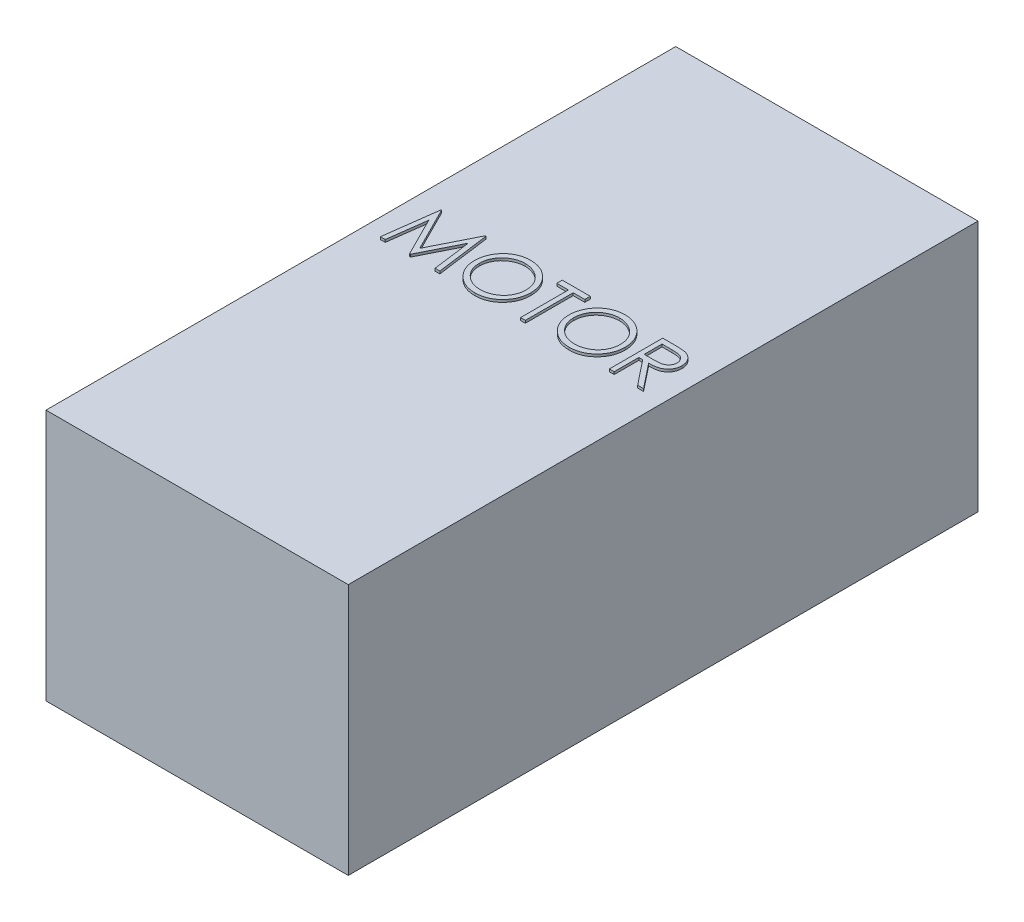
from build123d import *

# Parameters (mm, degrees)
SKETCH1_W           = 12
SKETCH1_H           = 10
BOSS_EXTRUDE1_DEPTH = 25
BOSS_EXTRUDE2_DEPTH = 0.1
SKETCH4_R           = 1.5
CUT_EXTRUDE1_DEPTH  = 5


with BuildPart() as part:
    # Sketch1 → Boss-Extrude1 (new body)
    with BuildSketch(Plane.XY):
        with Locations((6, 5)):
            Rectangle(SKETCH1_W, SKETCH1_H)
    extrude(amount=BOSS_EXTRUDE1_DEPTH)

    # Sketch3 → Boss-Extrude2 (add)
    # profile 1 of 5: a face of its own
    with BuildSketch(Plane(origin=(0, 10, 0), x_dir=(1, 0, 0), z_dir=(0, 1, 0))):
        Polygon((0.776175214, -12.5), (1.055598958, -10.383333333), (1.08273571, -10.383333333), (1.956623932, -12.12008547), (2.828392094, -10.383333333), (2.855952858, -10.383333333), (3.13707265, -12.5), (2.946267361, -12.5), (2.743589744, -10.976949786), (1.979520566, -12.5), (1.936695379, -12.5), (1.16965812, -10.973557692), (0.967404514, -12.5), align=None)
    # profile 2 of 5: a face of its own
    with BuildSketch(Plane(origin=(0, 10, 0), x_dir=(1, 0, 0), z_dir=(0, 1, 0))):
        with BuildLine():
            add(Edge.make_bspline(
                [(4.561752137, -10.329059829), (4.60094561, -10.330052533), (4.677924826, -10.332002286), (4.791060598, -10.346927268), (4.899068108, -10.372747813), (5.002827191, -10.407136379), (5.101096754, -10.453010221), (5.194616465, -10.508457906), (5.283163812, -10.574060336), (5.365545314, -10.649310392), (5.440933089, -10.731185148), (5.507351601, -10.818559884), (5.563015274, -10.910906302), (5.608726679, -11.0079469), (5.644588219, -11.109462214), (5.669334498, -11.215993444), (5.685141855, -11.326850347), (5.686989873, -11.402461832), (5.68792735, -11.440818643)],
                knots=[0, 0, 0, 0, 1.065120563, 2.091984664, 3.0946048, 4.079830382, 5.057816894, 6.036188127, 7.030412546, 8.04752943, 9.064399622, 10.05169764, 11.02544977, 11.989514704, 12.962713494, 13.945757189, 14.957906945, 16, 16, 16, 16], degree=3))
            add(Edge.make_bspline(
                [(5.68792735, -11.440818643), (5.68699001, -11.478892908), (5.685142404, -11.553941696), (5.669316525, -11.664095112), (5.644496491, -11.769983295), (5.609059702, -11.871429476), (5.563566198, -11.968540669), (5.50753188, -12.061061351), (5.441527434, -12.149021852), (5.366411862, -12.231458559), (5.28452647, -12.307052268), (5.196696737, -12.372922254), (5.10489792, -12.429603035), (5.007948715, -12.474829352), (4.907134884, -12.510977132), (4.801554145, -12.53562277), (4.691701229, -12.551520173), (4.616788765, -12.553345656), (4.578712607, -12.554273504)],
                knots=[0, 0, 0, 0, 1.043624062, 2.057103931, 3.04512605, 4.022047818, 4.998200453, 5.980619268, 6.982898556, 8.009068085, 9.034988726, 10.034168286, 11.015286542, 11.987931943, 12.962482838, 13.94673481, 14.956375938, 16, 16, 16, 16], degree=3))
            add(Edge.make_bspline(
                [(4.578712607, -12.554273504), (4.540355995, -12.553336494), (4.464744902, -12.551489398), (4.353748695, -12.535655881), (4.247142631, -12.510896141), (4.145231571, -12.475511863), (4.047958685, -12.429781442), (3.95513373, -12.374019746), (3.867129294, -12.307854475), (3.784674999, -12.232763261), (3.709231437, -12.151016656), (3.643457909, -12.063426416), (3.587683674, -11.971710973), (3.542106802, -11.875615803), (3.50602401, -11.775605455), (3.481407286, -11.671012804), (3.465480306, -11.562434151), (3.463644946, -11.488506303), (3.462713675, -11.450994925)],
                knots=[0, 0, 0, 0, 1.053102029, 2.075944431, 3.073151272, 4.055350789, 5.033113405, 6.020478099, 7.024410459, 8.052272461, 9.079885166, 10.07527673, 11.055994387, 12.023226415, 12.992069828, 13.970394897, 14.97016774, 16, 16, 16, 16], degree=3))
            add(Edge.make_bspline(
                [(3.462713675, -11.450994925), (3.463037002, -11.425817073), (3.463679578, -11.375778998), (3.471415506, -11.301473959), (3.482640916, -11.228363895), (3.498728739, -11.156656702), (3.519769414, -11.086527916), (3.544596116, -11.017493884), (3.574918785, -10.950254203), (3.609197081, -10.884490342), (3.647455413, -10.821227466), (3.689713604, -10.761428861), (3.734487375, -10.704592734), (3.783571903, -10.652191927), (3.835349468, -10.602702049), (3.890660011, -10.556883644), (3.949166035, -10.514323555), (4.011119283, -10.475969349), (4.074993192, -10.441280729), (4.14083772, -10.411513229), (4.207758599, -10.38596442), (4.276069267, -10.365256873), (4.345588324, -10.348908928), (4.416467499, -10.337776861), (4.488650323, -10.330021203), (4.537280026, -10.329381666), (4.561752137, -10.329059829)],
                knots=[0, 0, 0, 0, 1.037015668, 2.060948919, 3.074880161, 4.083647147, 5.086022904, 6.090072063, 7.104153813, 8.122640571, 9.144368836, 10.147691507, 11.138137339, 12.123020368, 13.103399296, 14.087645067, 15.080126199, 16.082011238, 17.087798457, 18.072939717, 19.057185487, 20.037253025, 21.01195951, 21.997135196, 22.992090687, 24, 24, 24, 24], degree=3))
        make_face()
        with BuildLine():
            add(Edge.make_bspline(
                [(4.571080395, -10.546153846), (4.55099345, -10.546398708), (4.511011593, -10.546886092), (4.451572849, -10.553306072), (4.392915823, -10.562456053), (4.335028399, -10.575507734), (4.278152786, -10.593290185), (4.221758834, -10.613755877), (4.166360797, -10.638684823), (4.112141559, -10.66685022), (4.059578633, -10.698025044), (4.009980475, -10.732479398), (3.963218686, -10.769405285), (3.919407758, -10.808888882), (3.878676335, -10.851131261), (3.840222729, -10.89549202), (3.805588268, -10.943239116), (3.773846991, -10.99307779), (3.74544263, -11.044943127), (3.720184535, -11.098289092), (3.699523444, -11.153550836), (3.68267334, -11.210128826), (3.668703454, -11.267933457), (3.659853414, -11.327403232), (3.653362892, -11.388239323), (3.652903367, -11.429352159), (3.65267094, -11.450146902)],
                knots=[0, 0, 0, 0, 1.008559885, 2.007477868, 2.99961109, 3.989939068, 4.984837346, 5.991145699, 7.001802488, 8.033829008, 9.059044045, 10.069351652, 11.065060232, 12.050310815, 13.029377138, 14.011219647, 14.996725999, 15.989392538, 16.977580475, 17.965360261, 18.951710183, 19.937753436, 20.929683414, 21.935841486, 22.955955122, 24, 24, 24, 24], degree=3))
            add(Edge.make_bspline(
                [(3.65267094, -11.450146902), (3.653441928, -11.480725007), (3.6549587, -11.540881599), (3.668237802, -11.629036619), (3.688692044, -11.713756678), (3.718843879, -11.794578214), (3.756551156, -11.872195947), (3.803134085, -11.945921324), (3.858324103, -12.015774272), (3.921015855, -12.081267125), (3.989549111, -12.141045302), (4.062321762, -12.193516506), (4.138554182, -12.237912229), (4.218445166, -12.274080058), (4.301568202, -12.302739566), (4.388458911, -12.322381405), (4.478538475, -12.335308466), (4.539940347, -12.336549895), (4.571080395, -12.337179487)],
                knots=[0, 0, 0, 0, 1.032063989, 2.030389145, 3.003944642, 3.970395727, 4.937377036, 5.913328081, 6.909231446, 7.93887556, 8.970685674, 9.976071282, 10.964166581, 11.944589148, 12.933237628, 13.927779006, 14.949070134, 16, 16, 16, 16], degree=3))
            add(Edge.make_bspline(
                [(4.571080395, -12.337179487), (4.592010903, -12.33689192), (4.633522387, -12.336321589), (4.69526587, -12.330577151), (4.755897007, -12.321365496), (4.815330758, -12.308102671), (4.873499667, -12.291503647), (4.930646525, -12.271783735), (4.986162633, -12.247181293), (5.040748345, -12.219998484), (5.092997501, -12.189010389), (5.142875561, -12.155725412), (5.18912532, -12.118853913), (5.232903473, -12.07995695), (5.273802123, -12.038250242), (5.311544699, -11.993788013), (5.346004112, -11.946289615), (5.377733336, -11.896526537), (5.406038167, -11.844519279), (5.430699812, -11.790979902), (5.451622225, -11.736040241), (5.468512321, -11.679621053), (5.481747814, -11.621829492), (5.490867576, -11.562588178), (5.497246869, -11.502015623), (5.497727702, -11.46104672), (5.497970085, -11.440394631)],
                knots=[0, 0, 0, 0, 1.047197238, 2.076906641, 3.100256066, 4.114471768, 5.12198147, 6.126382909, 7.136867548, 8.15857795, 9.17633901, 10.174870724, 11.156907918, 12.133735059, 13.104061851, 14.077631395, 15.04955518, 16.038496417, 17.029181396, 18.010275684, 18.986308667, 19.968651475, 20.955262928, 21.950658345, 22.966943676, 24, 24, 24, 24], degree=3))
            add(Edge.make_bspline(
                [(5.497970085, -11.440394631), (5.497727508, -11.419883826), (5.49724631, -11.379196867), (5.490870623, -11.319046753), (5.48173818, -11.260231715), (5.468576923, -11.202982653), (5.451613258, -11.147284974), (5.430696159, -11.093190988), (5.406030763, -11.040499175), (5.377722932, -10.989339767), (5.345902887, -10.940248378), (5.311132558, -10.893317395), (5.27281161, -10.849428166), (5.232034919, -10.807497184), (5.187783955, -10.768418746), (5.140259167, -10.732179888), (5.090037515, -10.697906051), (5.036862472, -10.666987259), (4.981983986, -10.63843389), (4.925672211, -10.613970664), (4.868565089, -10.593183716), (4.81080784, -10.575453932), (4.751914325, -10.562507171), (4.692282485, -10.553297826), (4.631994824, -10.546888326), (4.591449639, -10.54639945), (4.571080395, -10.546153846)],
                knots=[0, 0, 0, 0, 1.02996197, 2.043119294, 3.035359645, 4.018872909, 4.991431989, 5.957985074, 6.929999688, 7.912076566, 8.892894881, 9.867085534, 10.843653904, 11.817741046, 12.803660682, 13.806313499, 14.818574707, 15.856120519, 16.894564902, 17.924820532, 18.937903209, 19.946497019, 20.957711757, 21.963978472, 22.977135795, 24, 24, 24, 24], degree=3))
        make_face(mode=Mode.SUBTRACT)
    # profile 3 of 5: a face of its own
    with BuildSketch(Plane(origin=(0, 10, 0), x_dir=(1, 0, 0), z_dir=(0, 1, 0))):
        Polygon((5.877884615, -10.60042735), (5.877884615, -10.383333333), (6.990491453, -10.383333333), (6.990491453, -10.60042735), (6.529166667, -10.60042735), (6.529166667, -12.5), (6.339209402, -12.5), (6.339209402, -10.60042735), align=None)
    # profile 4 of 5: a face of its own
    with BuildSketch(Plane(origin=(0, 10, 0), x_dir=(1, 0, 0), z_dir=(0, 1, 0))):
        with BuildLine():
            add(Edge.make_bspline(
                [(8.306623932, -10.329059829), (8.345817405, -10.330052533), (8.422796621, -10.332002286), (8.535932392, -10.346927268), (8.643939902, -10.372747813), (8.747698986, -10.407136379), (8.845968548, -10.453010221), (8.93948826, -10.508457906), (9.028035607, -10.574060336), (9.110417109, -10.649310392), (9.185804884, -10.731185148), (9.252223396, -10.818559884), (9.307887069, -10.910906302), (9.353598474, -11.0079469), (9.389460014, -11.109462214), (9.414206293, -11.215993444), (9.43001365, -11.326850347), (9.431861668, -11.402461832), (9.432799145, -11.440818643)],
                knots=[0, 0, 0, 0, 1.065120563, 2.091984664, 3.0946048, 4.079830382, 5.057816894, 6.036188127, 7.030412546, 8.04752943, 9.064399622, 10.05169764, 11.02544977, 11.989514704, 12.962713494, 13.945757189, 14.957906945, 16, 16, 16, 16], degree=3))
            add(Edge.make_bspline(
                [(9.432799145, -11.440818643), (9.431861805, -11.478892908), (9.430014199, -11.553941696), (9.414188319, -11.664095112), (9.389368286, -11.769983295), (9.353931497, -11.871429476), (9.308437993, -11.968540669), (9.252403675, -12.061061351), (9.186399229, -12.149021852), (9.111283657, -12.231458559), (9.029398265, -12.307052268), (8.941568532, -12.372922254), (8.849769715, -12.429603035), (8.75282051, -12.474829352), (8.652006678, -12.510977132), (8.54642594, -12.53562277), (8.436573024, -12.551520173), (8.36166056, -12.553345656), (8.323584402, -12.554273504)],
                knots=[0, 0, 0, 0, 1.043624062, 2.057103931, 3.04512605, 4.022047818, 4.998200453, 5.980619268, 6.982898556, 8.009068085, 9.034988726, 10.034168286, 11.015286542, 11.987931943, 12.962482838, 13.94673481, 14.956375938, 16, 16, 16, 16], degree=3))
            add(Edge.make_bspline(
                [(8.323584402, -12.554273504), (8.28522779, -12.553336494), (8.209616697, -12.551489398), (8.09862049, -12.535655881), (7.992014426, -12.510896141), (7.890103366, -12.475511863), (7.79283048, -12.429781442), (7.700005525, -12.374019746), (7.612001089, -12.307854475), (7.529546794, -12.232763261), (7.454103232, -12.151016656), (7.388329704, -12.063426416), (7.332555469, -11.971710973), (7.286978597, -11.875615803), (7.250895805, -11.775605455), (7.226279081, -11.671012804), (7.210352101, -11.562434151), (7.208516741, -11.488506303), (7.20758547, -11.450994925)],
                knots=[0, 0, 0, 0, 1.053102029, 2.075944431, 3.073151272, 4.055350789, 5.033113405, 6.020478099, 7.024410459, 8.052272461, 9.079885166, 10.07527673, 11.055994387, 12.023226415, 12.992069828, 13.970394897, 14.97016774, 16, 16, 16, 16], degree=3))
            add(Edge.make_bspline(
                [(7.20758547, -11.450994925), (7.207908797, -11.425817073), (7.208551373, -11.375778998), (7.216287301, -11.301473959), (7.227512711, -11.228363895), (7.243600534, -11.156656702), (7.264641209, -11.086527916), (7.289467911, -11.017493884), (7.31979058, -10.950254203), (7.354068876, -10.884490342), (7.392327208, -10.821227466), (7.434585399, -10.761428861), (7.47935917, -10.704592734), (7.528443698, -10.652191927), (7.580221263, -10.602702049), (7.635531806, -10.556883644), (7.694037829, -10.514323555), (7.755991078, -10.475969349), (7.819864987, -10.441280729), (7.885709515, -10.411513229), (7.952630394, -10.38596442), (8.020941062, -10.365256873), (8.090460119, -10.348908928), (8.161339294, -10.337776861), (8.233522118, -10.330021203), (8.282151821, -10.329381666), (8.306623932, -10.329059829)],
                knots=[0, 0, 0, 0, 1.037015668, 2.060948919, 3.074880161, 4.083647147, 5.086022904, 6.090072063, 7.104153813, 8.122640571, 9.144368836, 10.147691507, 11.138137339, 12.123020368, 13.103399296, 14.087645067, 15.080126199, 16.082011238, 17.087798457, 18.072939717, 19.057185487, 20.037253025, 21.01195951, 21.997135196, 22.992090687, 24, 24, 24, 24], degree=3))
        make_face()
        with BuildLine():
            add(Edge.make_bspline(
                [(8.31595219, -10.546153846), (8.295865245, -10.546398708), (8.255883388, -10.546886092), (8.196444644, -10.553306072), (8.137787618, -10.562456053), (8.079900194, -10.575507734), (8.023024581, -10.593290185), (7.966630629, -10.613755877), (7.911232592, -10.638684823), (7.857013354, -10.66685022), (7.804450428, -10.698025044), (7.75485227, -10.732479398), (7.708090481, -10.769405285), (7.664279553, -10.808888882), (7.623548129, -10.851131261), (7.585094524, -10.89549202), (7.550460063, -10.943239116), (7.518718786, -10.99307779), (7.490314425, -11.044943127), (7.46505633, -11.098289092), (7.444395239, -11.153550836), (7.427545135, -11.210128826), (7.413575249, -11.267933457), (7.404725209, -11.327403232), (7.398234687, -11.388239323), (7.397775162, -11.429352159), (7.397542735, -11.450146902)],
                knots=[0, 0, 0, 0, 1.008559885, 2.007477868, 2.99961109, 3.989939068, 4.984837346, 5.991145699, 7.001802488, 8.033829008, 9.059044045, 10.069351652, 11.065060232, 12.050310815, 13.029377138, 14.011219647, 14.996725999, 15.989392538, 16.977580475, 17.965360261, 18.951710183, 19.937753436, 20.929683414, 21.935841486, 22.955955122, 24, 24, 24, 24], degree=3))
            add(Edge.make_bspline(
                [(7.397542735, -11.450146902), (7.398313723, -11.480725007), (7.399830495, -11.540881599), (7.413109597, -11.629036619), (7.433563838, -11.713756678), (7.463715674, -11.794578214), (7.501422951, -11.872195947), (7.54800588, -11.945921324), (7.603195898, -12.015774272), (7.66588765, -12.081267125), (7.734420906, -12.141045302), (7.807193557, -12.193516506), (7.883425977, -12.237912229), (7.963316961, -12.274080058), (8.046439997, -12.302739566), (8.133330706, -12.322381405), (8.22341027, -12.335308466), (8.284812142, -12.336549895), (8.31595219, -12.337179487)],
                knots=[0, 0, 0, 0, 1.032063989, 2.030389145, 3.003944642, 3.970395727, 4.937377036, 5.913328081, 6.909231446, 7.93887556, 8.970685674, 9.976071282, 10.964166581, 11.944589148, 12.933237628, 13.927779006, 14.949070134, 16, 16, 16, 16], degree=3))
            add(Edge.make_bspline(
                [(8.31595219, -12.337179487), (8.336882698, -12.33689192), (8.378394182, -12.336321589), (8.440137665, -12.330577151), (8.500768802, -12.321365496), (8.560202553, -12.308102671), (8.618371462, -12.291503647), (8.675518319, -12.271783735), (8.731034428, -12.247181293), (8.78562014, -12.219998484), (8.837869295, -12.189010389), (8.887747355, -12.155725412), (8.933997115, -12.118853913), (8.977775267, -12.07995695), (9.018673917, -12.038250242), (9.056416494, -11.993788013), (9.090875907, -11.946289615), (9.122605131, -11.896526537), (9.150909962, -11.844519279), (9.175571607, -11.790979902), (9.19649402, -11.736040241), (9.213384116, -11.679621053), (9.226619609, -11.621829492), (9.23573937, -11.562588178), (9.242118664, -11.502015623), (9.242599497, -11.46104672), (9.24284188, -11.440394631)],
                knots=[0, 0, 0, 0, 1.047197238, 2.076906641, 3.100256066, 4.114471768, 5.12198147, 6.126382909, 7.136867548, 8.15857795, 9.17633901, 10.174870724, 11.156907918, 12.133735059, 13.104061851, 14.077631395, 15.04955518, 16.038496417, 17.029181396, 18.010275684, 18.986308667, 19.968651475, 20.955262928, 21.950658345, 22.966943676, 24, 24, 24, 24], degree=3))
            add(Edge.make_bspline(
                [(9.24284188, -11.440394631), (9.242599302, -11.419883826), (9.242118105, -11.379196867), (9.235742418, -11.319046753), (9.226609974, -11.260231715), (9.213448718, -11.202982653), (9.196485053, -11.147284974), (9.175567953, -11.093190988), (9.150902558, -11.040499175), (9.122594727, -10.989339767), (9.090774681, -10.940248378), (9.056004353, -10.893317395), (9.017683405, -10.849428166), (8.976906713, -10.807497184), (8.93265575, -10.768418746), (8.885130962, -10.732179888), (8.834909309, -10.697906051), (8.781734267, -10.666987259), (8.726855781, -10.63843389), (8.670544006, -10.613970664), (8.613436884, -10.593183716), (8.555679635, -10.575453932), (8.49678612, -10.562507171), (8.43715428, -10.553297826), (8.376866619, -10.546888326), (8.336321434, -10.54639945), (8.31595219, -10.546153846)],
                knots=[0, 0, 0, 0, 1.02996197, 2.043119294, 3.035359645, 4.018872909, 4.991431989, 5.957985074, 6.929999688, 7.912076566, 8.892894881, 9.867085534, 10.843653904, 11.817741046, 12.803660682, 13.806313499, 14.818574707, 15.856120519, 16.894564902, 17.924820532, 18.937903209, 19.946497019, 20.957711757, 21.963978472, 22.977135795, 24, 24, 24, 24], degree=3))
        make_face(mode=Mode.SUBTRACT)
    # profile 5 of 5: a face of its own
    with BuildSketch(Plane(origin=(0, 10, 0), x_dir=(1, 0, 0), z_dir=(0, 1, 0))):
        with BuildLine():
            Line((9.866987179, -10.383333333), (10.29057492, -10.383333333))
            add(Edge.make_bspline(
                [(10.29057492, -10.383333333), (10.318842174, -10.383427426), (10.373118433, -10.383608094), (10.450874648, -10.384615484), (10.521527226, -10.387502832), (10.585039224, -10.389987547), (10.641409477, -10.394518388), (10.690810839, -10.398848874), (10.73301578, -10.404517707), (10.758564461, -10.409782415), (10.770132212, -10.412166132)],
                knots=[0, 0, 0, 0, 1.410062039, 2.707475311, 3.878576406, 4.937260626, 5.877586885, 6.699081471, 7.410979367, 8, 8, 8, 8], degree=3))
            add(Edge.make_bspline(
                [(10.770132212, -10.412166132), (10.785618122, -10.415992319), (10.816259587, -10.42356307), (10.860377008, -10.439564828), (10.902416623, -10.458082411), (10.942203803, -10.479831899), (10.979539257, -10.504974742), (11.01480795, -10.533076892), (11.048169921, -10.563984583), (11.078275954, -10.598477082), (11.106662905, -10.634663924), (11.130604598, -10.673794291), (11.151242993, -10.714713405), (11.167674686, -10.757837415), (11.180905651, -10.802748106), (11.190234853, -10.849852283), (11.195829619, -10.898935349), (11.196399217, -10.932413703), (11.196688034, -10.949389022)],
                knots=[0, 0, 0, 0, 1.027469482, 2.033020251, 3.019912614, 3.986113645, 4.951240523, 5.91722682, 6.890402269, 7.87763091, 8.8651537, 9.85103654, 10.82876324, 11.815024772, 12.821070561, 13.842952187, 14.906261191, 16, 16, 16, 16], degree=3))
            add(Edge.make_bspline(
                [(11.196688034, -10.949389022), (11.19579964, -10.977592157), (11.194066153, -11.032623778), (11.177903829, -11.112489168), (11.151429457, -11.186989372), (11.11494823, -11.256030587), (11.068490737, -11.318267025), (11.012656221, -11.372931729), (10.947413532, -11.418675866), (10.886677708, -11.450397324), (10.833026739, -11.470713036), (10.788858974, -11.485007405), (10.740679421, -11.496051546), (10.688949699, -11.505945531), (10.633454536, -11.513415365), (10.574326941, -11.5188864), (10.511524745, -11.522305754), (10.468381593, -11.522814966), (10.446187233, -11.523076923)],
                knots=[0, 0, 0, 0, 1.260483769, 2.459530307, 3.627416485, 4.787058657, 5.939039949, 7.08810263, 8.267026773, 9.491475466, 10.141966685, 10.831826277, 11.566392101, 12.351337768, 13.187381173, 14.07005841, 15.007169909, 16, 16, 16, 16], degree=3))
            Line((10.446187233, -11.523076923), (11.223824786, -12.5))
            Line((11.223824786, -12.5), (10.988922276, -12.5))
            Line((10.988922276, -12.5), (10.211284722, -11.523076923))
            Line((10.211284722, -11.523076923), (10.056944444, -11.523076923))
            Line((10.056944444, -11.523076923), (10.056944444, -12.5))
            Line((10.056944444, -12.5), (9.866987179, -12.5))
            Line((9.866987179, -12.5), (9.866987179, -10.383333333))
        make_face()
        with BuildLine():
            Line((10.056944444, -10.60042735), (10.056944444, -11.305982906))
            Line((10.056944444, -11.305982906), (10.444491186, -11.308950988))
            add(Edge.make_bspline(
                [(10.444491186, -11.308950988), (10.462585686, -11.308958993), (10.49765798, -11.308974509), (10.548397906, -11.306559226), (10.595641973, -11.3038116), (10.639209476, -11.2996089), (10.679119876, -11.294192609), (10.715353226, -11.287417471), (10.747968671, -11.279524081), (10.786007311, -11.267306907), (10.82848369, -11.247950887), (10.874646049, -11.219789847), (10.913956987, -11.184369475), (10.947169218, -11.14386648), (10.973857017, -11.099334082), (10.992672402, -11.051306087), (11.004611879, -11.000994978), (11.006020094, -10.966415837), (11.006730769, -10.948965011)],
                knots=[0, 0, 0, 0, 1.146690395, 2.22261258, 3.21895312, 4.145990853, 4.996080663, 5.770904154, 6.481378293, 7.121626537, 8.300444488, 9.431385265, 10.535395872, 11.636531494, 12.74115979, 13.810798291, 14.895190096, 16, 16, 16, 16], degree=3))
            add(Edge.make_bspline(
                [(11.006730769, -10.948965011), (11.006003772, -10.931943035), (11.004563129, -10.898211691), (10.992801255, -10.848829307), (10.97291101, -10.802222151), (10.946106609, -10.75857982), (10.913449977, -10.718964446), (10.875157776, -10.685069263), (10.832277015, -10.657099349), (10.792198719, -10.639225986), (10.756376124, -10.628267789), (10.725273425, -10.62055637), (10.690129817, -10.614360906), (10.650774659, -10.609396983), (10.607375958, -10.605130422), (10.559714279, -10.602256727), (10.508105845, -10.600555009), (10.472336034, -10.600470894), (10.453819444, -10.60042735)],
                knots=[0, 0, 0, 0, 1.101028733, 2.181837193, 3.264309656, 4.369019818, 5.486613113, 6.575447106, 7.666700264, 8.788928104, 9.402425223, 10.0903467, 10.862060571, 11.710948788, 12.657782767, 13.684531032, 14.801375019, 16, 16, 16, 16], degree=3))
            Line((10.453819444, -10.60042735), (10.056944444, -10.60042735))
        make_face(mode=Mode.SUBTRACT)
    extrude(amount=BOSS_EXTRUDE2_DEPTH)

    # Sketch4 → Cut-Extrude1 (cut)
    with BuildSketch(Plane(origin=(0, 0, 0), x_dir=(-1, 0, 0), z_dir=(0, 0, -1))):
        with Locations((-6, 5)):
            Circle(SKETCH4_R)
    extrude(amount=-CUT_EXTRUDE1_DEPTH, mode=Mode.SUBTRACT)


solid = part.part
